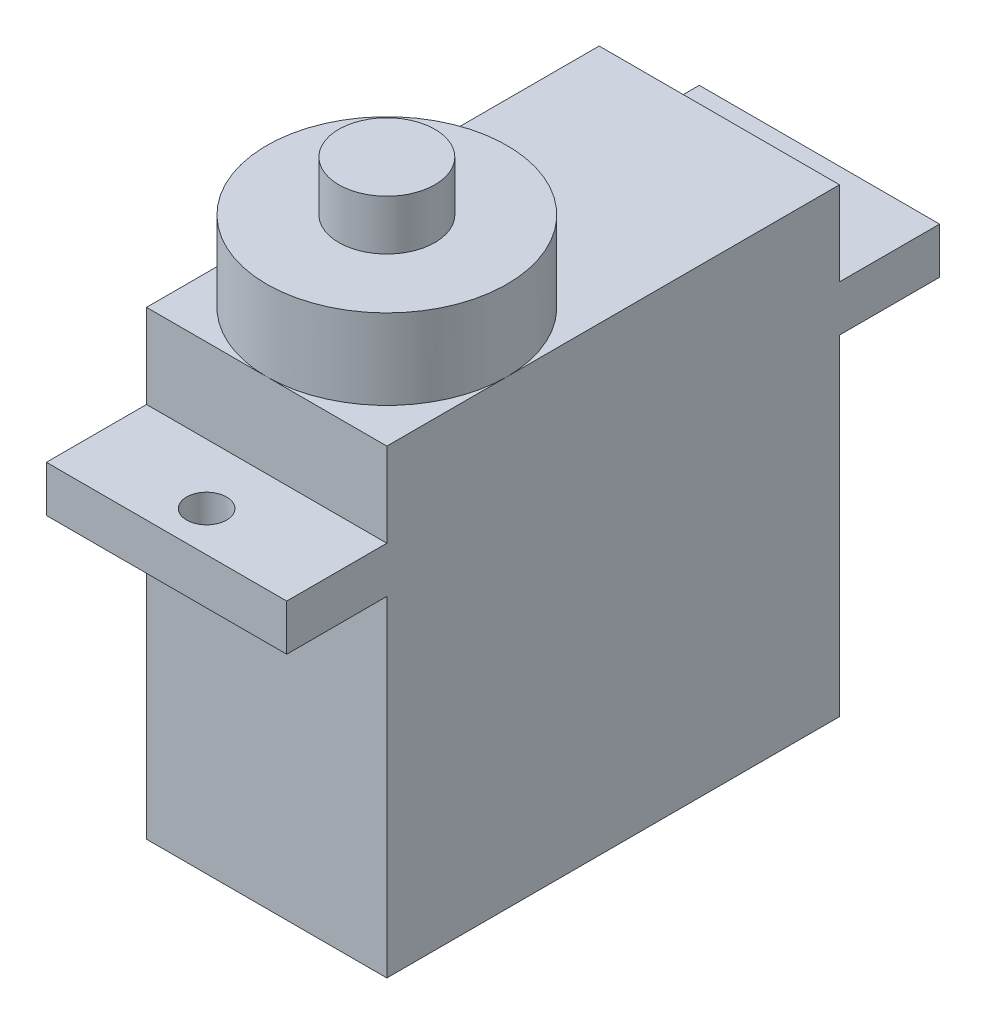
from build123d import *

# Parameters (mm, degrees)
SKETCH1_W           = 22.6
SKETCH1_H           = 23
BOSS_EXTRUDE1_DEPTH = 12
SKETCH2_R           = 6
BOSS_EXTRUDE2_DEPTH = 4
SKETCH3_R           = 2.4
BOSS_EXTRUDE3_DEPTH = 2.5
SKETCH4_W           = 12
SKETCH4_H           = 5
SKETCH4_R           = 1
BOSS_EXTRUDE4_DEPTH = 2.3


with BuildPart() as part:
    # Sketch1 → Boss-Extrude1 (new body)
    with BuildSketch(Plane(origin=(0, 0, 0), x_dir=(0, 0, -1), z_dir=(1, 0, 0))):
        with Locations((11.3, 11.5)):
            Rectangle(SKETCH1_W, SKETCH1_H)
    extrude(amount=BOSS_EXTRUDE1_DEPTH)

    # Sketch2 → Boss-Extrude2 (add)
    with BuildSketch(Plane(origin=(0, 23, 0), x_dir=(1, 0, 0), z_dir=(0, 1, 0))):
        with Locations(Location((6, 6, 0), (0, 0, 270))):
            Circle(SKETCH2_R)
    extrude(amount=BOSS_EXTRUDE2_DEPTH)

    # Sketch3 → Boss-Extrude3 (add)
    with BuildSketch(Plane(origin=(0, 27, 0), x_dir=(1, 0, 0), z_dir=(0, 1, 0))):
        with Locations(Location((6, 6, 0), (0, 0, 270))):
            Circle(SKETCH3_R)
    extrude(amount=BOSS_EXTRUDE3_DEPTH)

    # Sketch4 → Boss-Extrude4 (add)
    # profile 1 of 2: a face of its own
    with BuildSketch(Plane(origin=(0, 16.5, 0), x_dir=(1, 0, 0), z_dir=(0, 1, 0))):
        with Locations((6, -2.5)):
            Rectangle(SKETCH4_W, SKETCH4_H)
        with Locations(Location((6, -3, 0), (0, 0, 270))):
            Circle(SKETCH4_R, mode=Mode.SUBTRACT)
    # profile 2 of 2: a face of its own
    with BuildSketch(Plane(origin=(0, 16.5, 0), x_dir=(1, 0, 0), z_dir=(0, 1, 0))):
        with Locations((6, 25.1)):
            Rectangle(SKETCH4_W, SKETCH4_H)
        with Locations(Location((6, 25.6, 0), (0, 0, 270))):
            Circle(SKETCH4_R, mode=Mode.SUBTRACT)
    extrude(amount=BOSS_EXTRUDE4_DEPTH)


solid = part.part
